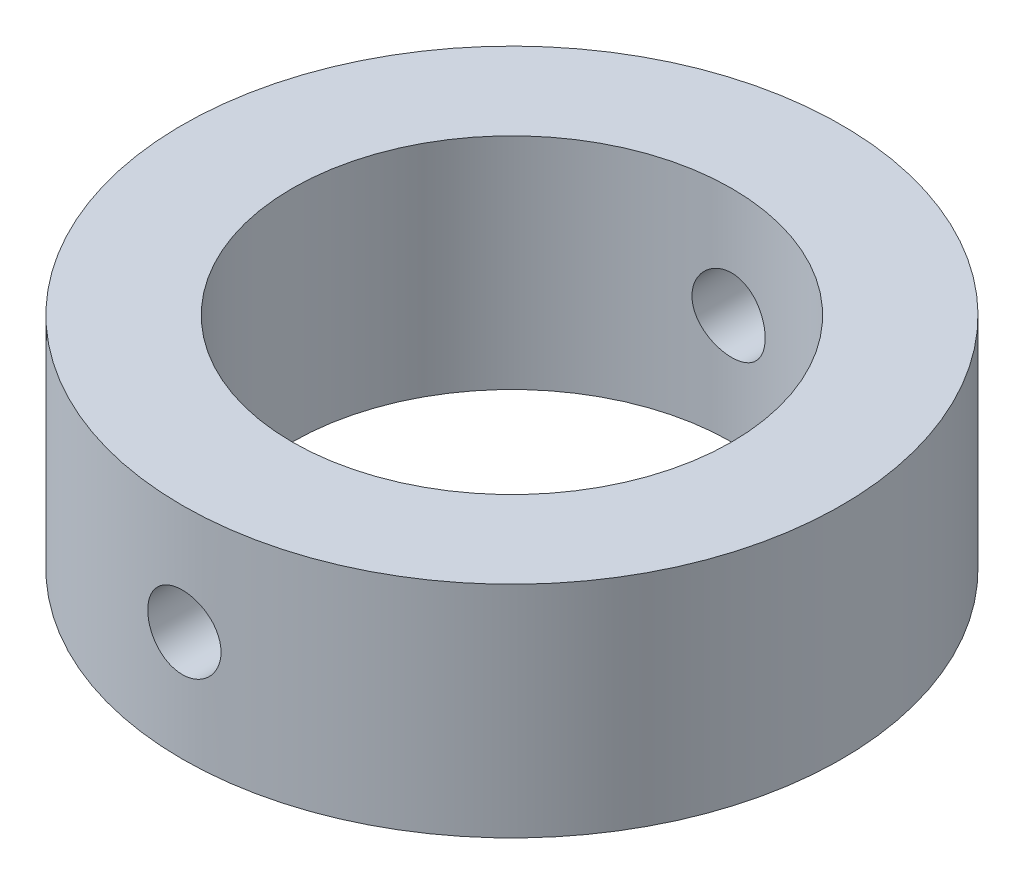
from build123d import *

# Parameters (mm, degrees)
SKETCH1_R               = 22.5
SKETCH1_R_2             = 15
BOSS_EXTRUDE1_DEPTH     = 7.5
CUT_EXTRUDE1_DEPTH      = 33.691742077
CUT_EXTRUDE1_DEPTH_BACK = 33.691742077
SKETCH2_R               = 2.499519508


with BuildPart() as part:
    # Sketch1 → Boss-Extrude1 (new, symmetric)
    with BuildSketch(Plane(origin=(0, 0, 0), x_dir=(1, 0, 0), z_dir=(0, 1, 0))):
        with Locations(Location((0, 0, 0), (0, 0, 270))):
            Circle(SKETCH1_R)
        with Locations(Location((0, 0, 0), (0, 0, 270))):
            Circle(SKETCH1_R_2, mode=Mode.SUBTRACT)
    extrude(amount=BOSS_EXTRUDE1_DEPTH, both=True)

    # Sketch2 → Cut-Extrude1 (cut, two sides: drawn at the far end of the back side and taken through both)
    with BuildSketch(Plane.XY.offset(-CUT_EXTRUDE1_DEPTH_BACK)):
        Circle(SKETCH2_R)
    extrude(amount=CUT_EXTRUDE1_DEPTH + CUT_EXTRUDE1_DEPTH_BACK, mode=Mode.SUBTRACT)


solid = part.part
